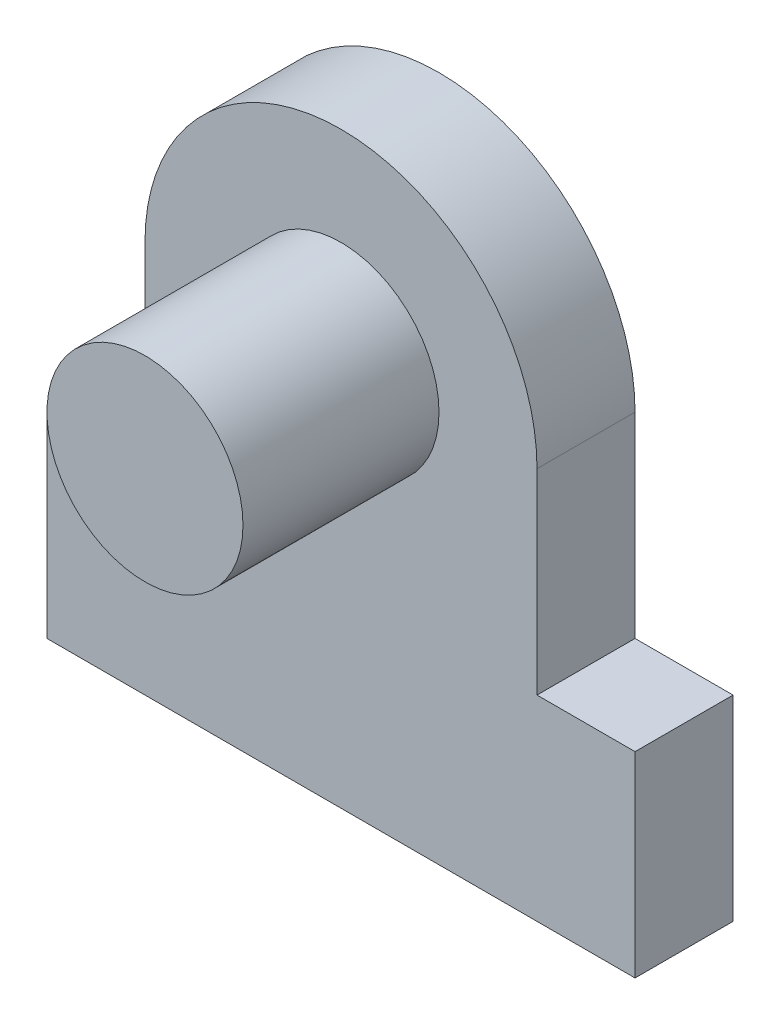
from build123d import *

# Parameters (mm, degrees)
BOSS_EXTRUDE1_DEPTH = 10
SKETCH2_R           = 10
BOSS_EXTRUDE2_DEPTH = 20


with BuildPart() as part:
    # Sketch1 → Boss-Extrude1 (new body)
    with BuildSketch(Plane.XY):
        with BuildLine():
            Line((-30, 0), (30, 0))
            Line((30, 0), (30, 20))
            Line((30, 20), (20, 20))
            Line((20, 20), (20, 40))
            ThreePointArc((20, 40), (0, 60), (-20, 40))
            Line((-20, 40), (-20, 20))
            Line((-20, 20), (-30, 20))
            Line((-30, 20), (-30, 0))
        make_face()
    extrude(amount=BOSS_EXTRUDE1_DEPTH)

    # Sketch2 → Boss-Extrude2 (add)
    with BuildSketch(Plane.XY.offset(10)):
        with Locations((0, 40)):
            Circle(SKETCH2_R)
    extrude(amount=BOSS_EXTRUDE2_DEPTH)


solid = part.part
